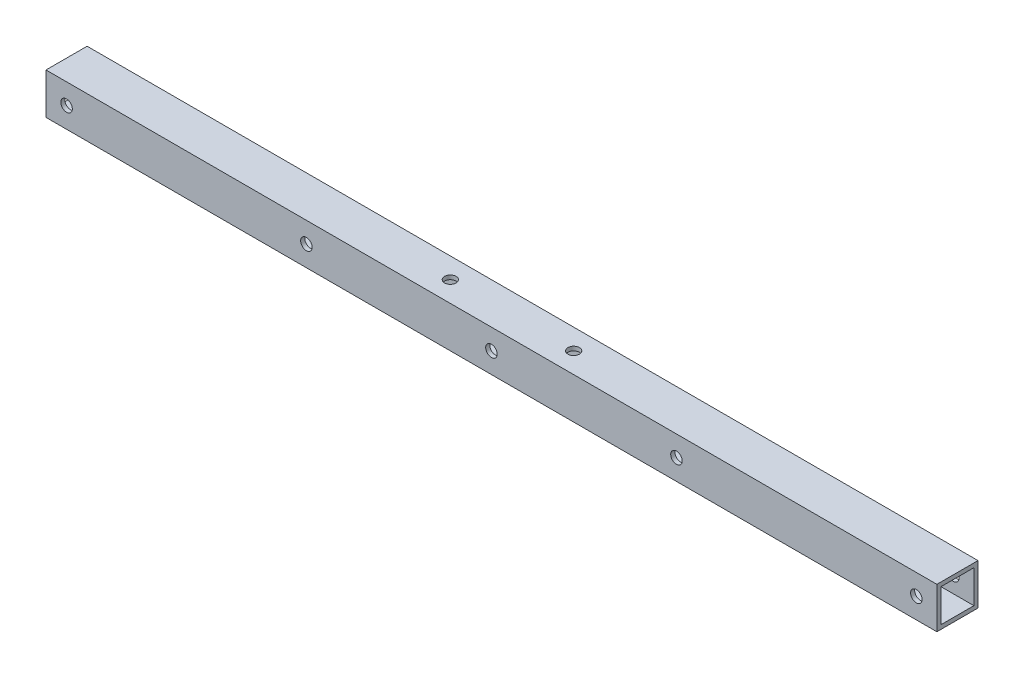
from build123d import *

# Parameters (mm, degrees)
SKETCH_1_W          = 15
SKETCH_1_H          = 15
SKETCH_1_W_2        = 12
SKETCH_1_H_2        = 12
EXTRUDE_1_DEPTH     = 325
SKETCH_2_R          = 2.1
CUT_EXTRUDE_1_DEPTH = 326.432404656
SKETCH_3_R          = 2.1
CUT_EXTRUDE_2_DEPTH = 326.432404656
SKETCH_4_R          = 2.1
CUT_EXTRUDE_3_DEPTH = 326.432404656


with BuildPart() as part:
    # ｽｹｯﾁ1 → 押し出し-薄板1 (new body)
    with BuildSketch(Plane(origin=(0, 0, 0), x_dir=(0, 0, -1), z_dir=(1, 0, 0))):
        Rectangle(SKETCH_1_W, SKETCH_1_H)
        Rectangle(SKETCH_1_W_2, SKETCH_1_H_2, mode=Mode.SUBTRACT)
    extrude(amount=EXTRUDE_1_DEPTH)

    # ｽｹｯﾁ2 → ｶｯﾄ - 押し出し1 (cut, through all)
    with BuildSketch(Plane.XY.offset(7.5)):
        with Locations((7.5, 0)):
            Circle(SKETCH_2_R)
        with Locations(Location((317.5, 0, 0), (0, 0, 90))):
            Circle(SKETCH_2_R)
    extrude(amount=-CUT_EXTRUDE_1_DEPTH, mode=Mode.SUBTRACT)

    # ｽｹｯﾁ3 → ｶｯﾄ - 押し出し2 (cut, through all)
    with BuildSketch(Plane.XY.offset(7.5)):
        with Locations((95, 0)):
            Circle(SKETCH_3_R)
        with Locations(Location((230, 0, 0), (0, 0, 90))):
            Circle(SKETCH_3_R)
        with Locations((162.5, 0)):
            Circle(SKETCH_3_R)
    extrude(amount=-CUT_EXTRUDE_2_DEPTH, mode=Mode.SUBTRACT)

    # ｽｹｯﾁ4 → ｶｯﾄ - 押し出し3 (cut, through all)
    with BuildSketch(Plane(origin=(0, 7.5, 0), x_dir=(1, 0, 0), z_dir=(0, 1, 0))):
        with Locations(Location((140, 0, 0), (0, 0, 270))):
            Circle(SKETCH_4_R)
        with Locations(Location((185, 0, 0), (0, 0, 270))):
            Circle(SKETCH_4_R)
    extrude(amount=-CUT_EXTRUDE_3_DEPTH, mode=Mode.SUBTRACT)


solid = part.part
